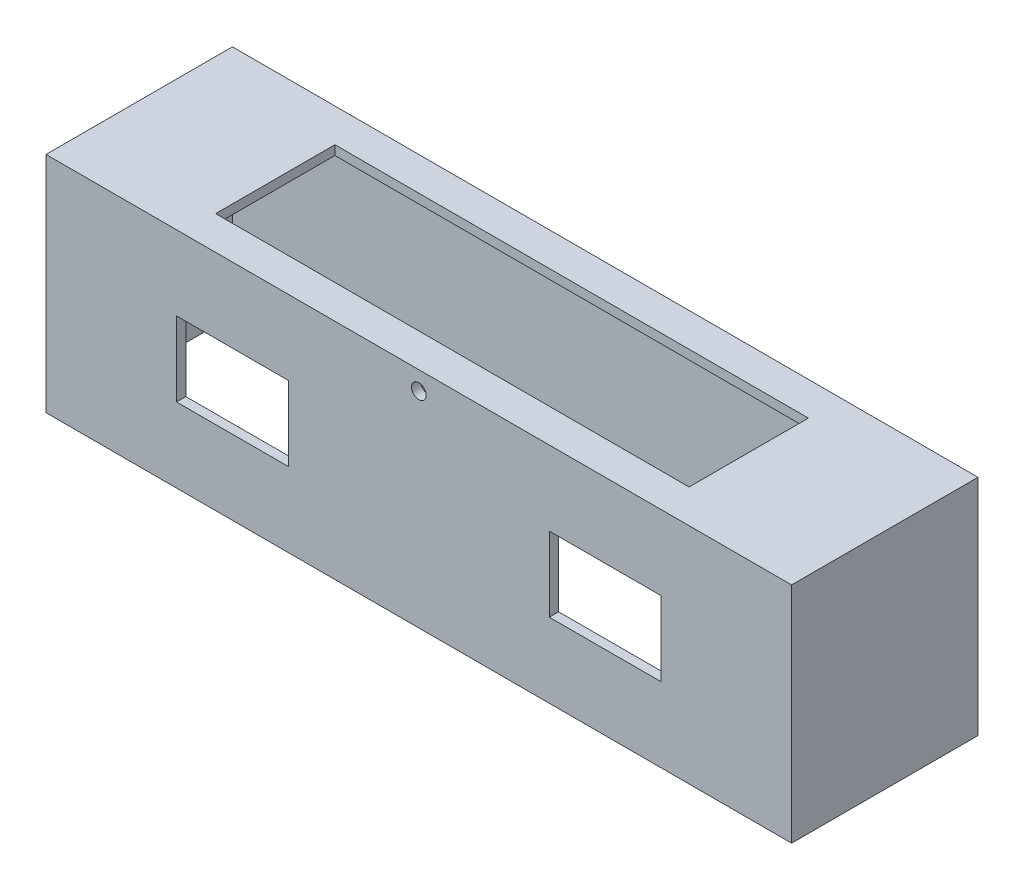
from build123d import *

# Parameters (mm, degrees)
SKETCH1_W           = 254
SKETCH1_H           = 63.5
BOSS_EXTRUDE1_DEPTH = 76.2
SHELL1_T            = -3.175
CUT_EXTRUDE1_REACH  = 163.145
SKETCH2_W           = 38.1
SKETCH2_H           = 25.4
SKETCH3_R           = 2.5
CUT_EXTRUDE2_DEPTH  = 162.144934764
SKETCH4_W           = 161.29
SKETCH4_H           = 40.64
CUT_EXTRUDE3_DEPTH  = 152.471127612


with BuildPart() as part:
    # Sketch1 → Boss-Extrude1 (new body)
    with BuildSketch(Plane(origin=(0, 0, 0), x_dir=(1, 0, 0), z_dir=(0, 1, 0))):
        Rectangle(SKETCH1_W, SKETCH1_H)
    extrude(amount=BOSS_EXTRUDE1_DEPTH)

    # Shell1
    shell1_openings = [part.faces().sort_by_distance(p)[0] for p in [
        (0, 0, 0),
    ]]
    offset(amount=SHELL1_T, openings=shell1_openings, kind=Kind.INTERSECTION)

    # Sketch2 → Cut-Extrude1 (cut, up to next)
    with BuildSketch(Plane.XY.offset(31.75), mode=Mode.PRIVATE) as cut_extrude1_sk1:
        with Locations((63.5, 38.1)):
            Rectangle(SKETCH2_W, SKETCH2_H)
    cut_extrude1_tool1 = extrude(cut_extrude1_sk1.sketch, amount=-CUT_EXTRUDE1_REACH, mode=Mode.PRIVATE) & part.part
    # Sketch2 → Cut-Extrude1 (cut, up to next)
    with BuildSketch(Plane.XY.offset(31.75), mode=Mode.PRIVATE) as cut_extrude1_sk2:
        with Locations((-63.5, 38.1)):
            Rectangle(SKETCH2_W, SKETCH2_H)
    cut_extrude1_tool2 = extrude(cut_extrude1_sk2.sketch, amount=-CUT_EXTRUDE1_REACH, mode=Mode.PRIVATE) & part.part
    add(cut_extrude1_tool1.solids().sort_by_distance((63.5, 38.1, 31.75))[0], mode=Mode.SUBTRACT)
    add(cut_extrude1_tool2.solids().sort_by_distance((-63.5, 38.1, 31.75))[0], mode=Mode.SUBTRACT)

    # Sketch3 → Cut-Extrude2 (cut, through all)
    with BuildSketch(Plane(origin=(0, 0, -31.75), x_dir=(-1, 0, 0), z_dir=(0, 0, -1))):
        with Locations((0, 69.85)):
            Circle(SKETCH3_R)
    extrude(amount=-CUT_EXTRUDE2_DEPTH, mode=Mode.SUBTRACT)

    # Sketch4 → Cut-Extrude3 (cut, through all)
    with BuildSketch(Plane(origin=(0, 76.2, 0), x_dir=(1, 0, 0), z_dir=(0, 1, 0))):
        Rectangle(SKETCH4_W, SKETCH4_H)
    extrude(amount=-CUT_EXTRUDE3_DEPTH, mode=Mode.SUBTRACT)


solid = part.part
